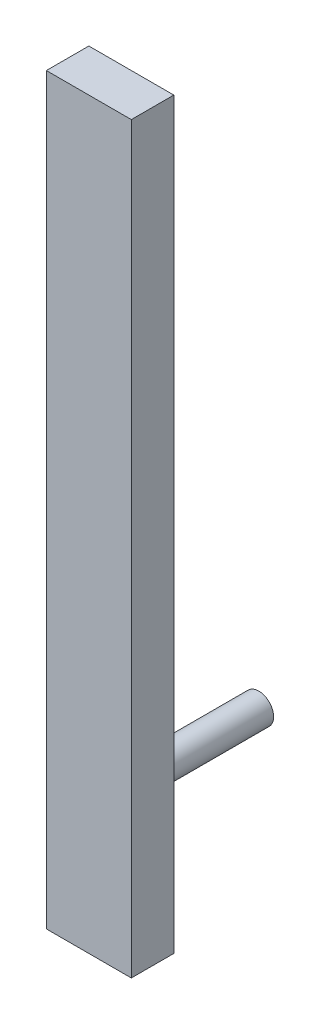
from build123d import *

# Parameters (mm, degrees)
SKETCH1_W      = 40
SKETCH1_H      = 350
EXTRUDE1_DEPTH = 20
SKETCH2_R      = 7
EXTRUDE2_DEPTH = 60


with BuildPart() as part:
    # Sketch1 → Extrude1 (new body)
    with BuildSketch(Plane.XY):
        with Locations((181.317621291, 114.5)):
            Rectangle(SKETCH1_W, SKETCH1_H)
    extrude(amount=EXTRUDE1_DEPTH)

    # Sketch2 → Extrude2 (add)
    with BuildSketch(Plane(origin=(0, 0, 0), x_dir=(-1, 0, 0), z_dir=(0, 0, -1))):
        with Locations(Location((-181.317621291, -0.5, 0), (0, 0, 180))):
            Circle(SKETCH2_R)
    extrude(amount=EXTRUDE2_DEPTH)


solid = part.part
